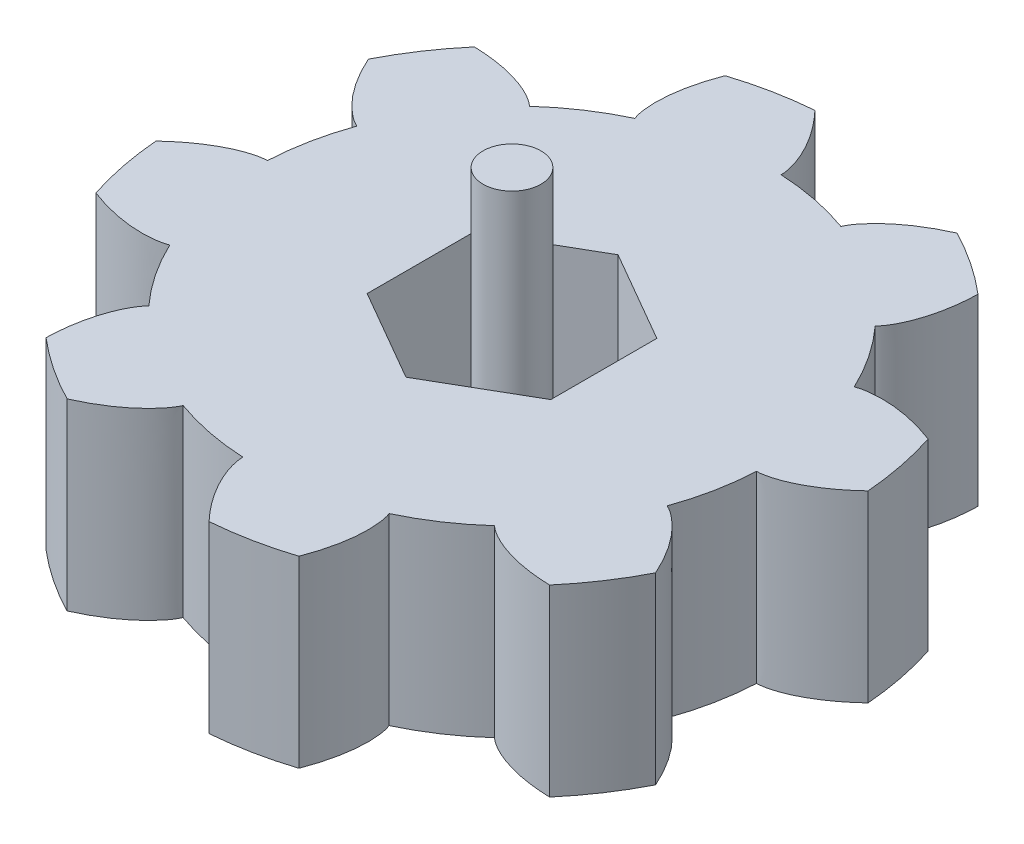
from build123d import *

# Parameters (mm, degrees)
SKETCH_1_R               = 14
EXTRUDE_1_DEPTH          = 10
EXTRUDE_2_DEPTH          = 10
PATTERN_CIRCULAR_1_COUNT = 8
CUT_EXTRUDE_2_DEPTH      = 8
SKETCH_8_R               = 1.575
EXTRUDE_5_DEPTH          = 15


with BuildPart() as part:
    # ｽｹｯﾁ1 → ﾎﾞｽ - 押し出し1 (new body)
    with BuildSketch(Plane(origin=(0, 0, 0), x_dir=(1, 0, 0), z_dir=(0, 1, 0))):
        with Locations(Location((0, 0, 0), (0, 0, 270))):
            Circle(SKETCH_1_R)
    extrude(amount=EXTRUDE_1_DEPTH)

    # ｽｹｯﾁ3 → ﾎﾞｽ - 押し出し2 (add)
    with BuildSketch(Plane(origin=(0, 0, 0), x_dir=(1, 0, 0), z_dir=(0, 1, 0))):
        with BuildLine():
            ThreePointArc((0.670662773, 13.983926896), (-2.731264508, 13.730993926), (-5.971028752, 12.662812312))
            add(Edge.make_bspline(
                [(-5.528304984, 17.130027554), (-5.669447216, 16.763315044), (-5.860218101, 16.179410176), (-6.038366418, 15.38918786), (-6.12675066, 14.806480124), (-6.167823232, 14.2902167), (-6.171562682, 13.84380553), (-6.148097009, 13.46960438), (-6.10787192, 13.168784501), (-6.053435711, 12.906118131), (-6.005913858, 12.745636704), (-5.971028752, 12.662812312)],
                knots=[0, 0, 0, 0, 0.257950131, 0.40241706, 0.531259136, 0.64447636, 0.742068735, 0.824036262, 0.890378946, 0.941096793, 1, 1, 1, 1], degree=3))
            ThreePointArc((-5.528304984, 17.130027554), (-3.511625796, 17.654135047), (-1.447889917, 17.941672575))
            add(Edge.make_bspline(
                [(-1.447889917, 17.941672575), (-1.177156696, 17.656887186), (-0.77745666, 17.190434286), (-0.310464088, 16.528538472), (-0.0058151, 16.024009907), (0.229696468, 15.562762489), (0.403985429, 15.151763371), (0.525506554, 14.797066663), (0.603462201, 14.50375186), (0.65368777, 14.240247941), (0.671196886, 14.073796609), (0.670662773, 13.983926896)],
                knots=[0, 0, 0, 0, 0.257950131, 0.40241706, 0.531259136, 0.64447636, 0.742068735, 0.824036262, 0.890378946, 0.941096793, 1, 1, 1, 1], degree=3))
        make_face()
    extrude_2 = extrude(amount=EXTRUDE_2_DEPTH)

    # 円形ﾊﾟﾀｰﾝ1: ﾎﾞｽ - 押し出し2 ×8 about axis
    pattern_circular_1_axis = Axis((0, 10, 0), (0, 1, 0))
    for i in range(1, PATTERN_CIRCULAR_1_COUNT):
        add(extrude_2.rotate(pattern_circular_1_axis, i * 360 / PATTERN_CIRCULAR_1_COUNT))

    # ｽｹｯﾁ6 → ｶｯﾄ - 押し出し2 (cut)
    with BuildSketch(Plane(origin=(0, 10, 0), x_dir=(1, 0, 0), z_dir=(0, 1, 0))):
        Polygon((0, 5.773502692), (-5, 2.886751346), (-5, -2.886751346), (0, -5.773502692), (5, -2.886751346), (5, 2.886751346), align=None)
    extrude(amount=-CUT_EXTRUDE_2_DEPTH, mode=Mode.SUBTRACT)

    # ｽｹｯﾁ8 → ﾎﾞｽ - 押し出し5 (add)
    with BuildSketch(Plane(origin=(0, 2, 0), x_dir=(1, 0, 0), z_dir=(0, 1, 0))):
        with Locations(Location((0, 0, 0), (0, 0, 270))):
            Circle(SKETCH_8_R)
    extrude(amount=EXTRUDE_5_DEPTH)


solid = part.part
